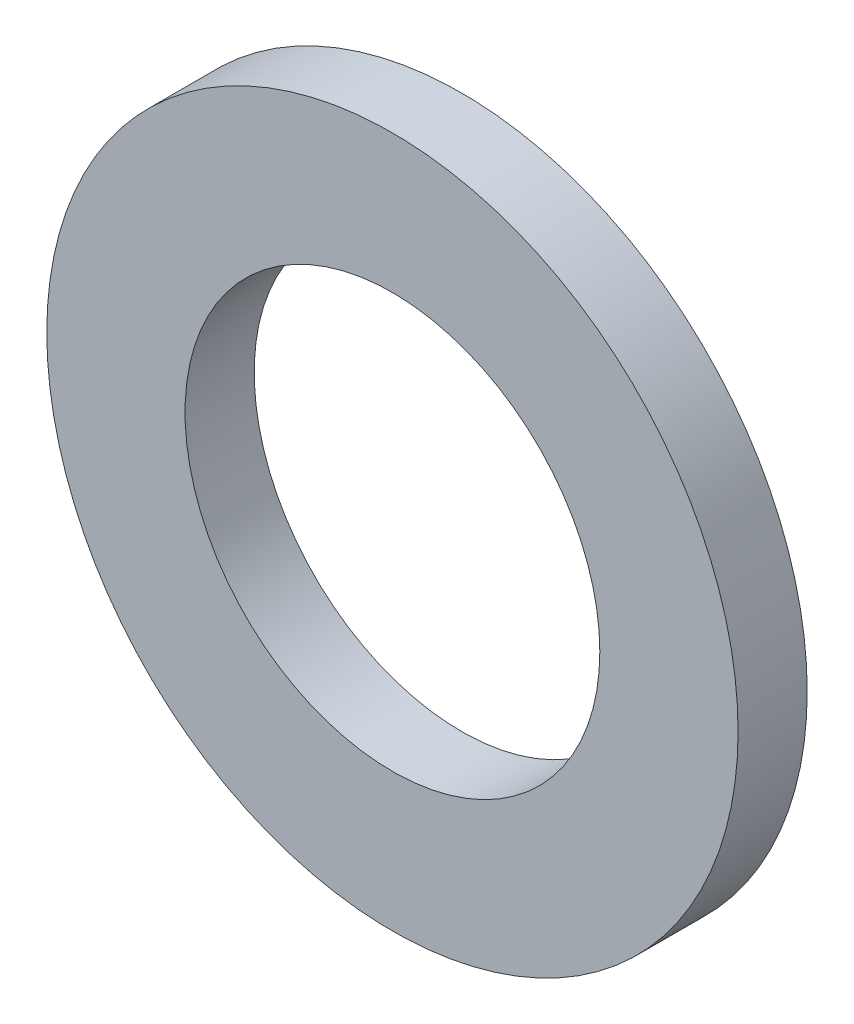
from build123d import *

# Parameters (mm, degrees)
SKETCH1_R           = 4
SKETCH1_R_2         = 2.4
BOSS_EXTRUDE1_DEPTH = 0.8


with BuildPart() as part:
    # Sketch1 → Boss-Extrude1 (new body)
    with BuildSketch(Plane.XY):
        Circle(SKETCH1_R)
        Circle(SKETCH1_R_2, mode=Mode.SUBTRACT)
    extrude(amount=BOSS_EXTRUDE1_DEPTH)


solid = part.part
